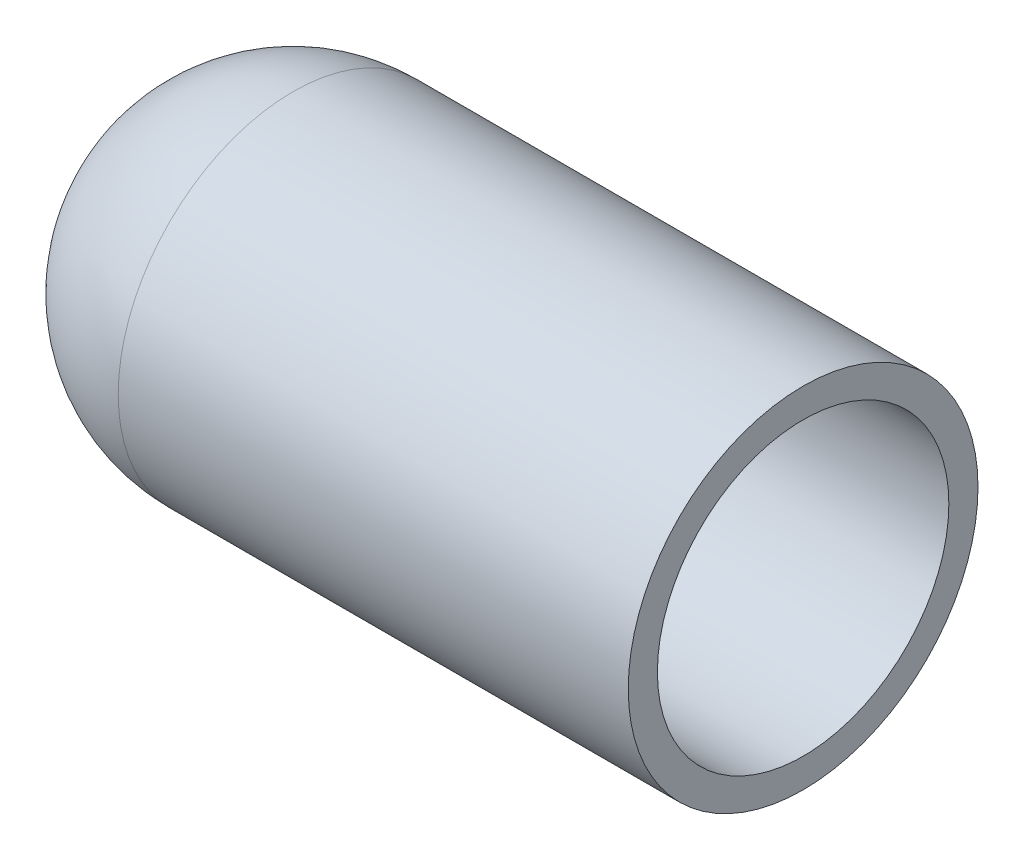
from build123d import *

# Parameters (mm, degrees)
SHELL1_T = -2


with BuildPart() as part:
    # Sketch1 → Revolve1 (revolve)
    with BuildSketch(Plane(origin=(0, 0, 0), x_dir=(1, 0, 0), z_dir=(0, 1, 0)), mode=Mode.PRIVATE) as revolve1_sk:
        with BuildLine():
            Line((-16.159952826, 12), (18.840047174, 12))
            Line((18.840047174, 12), (18.840047174, 0))
            Line((18.840047174, 0), (-28.159952826, 0))
            ThreePointArc((-28.159952826, 0), (-24.645234201, 8.485281374), (-16.159952826, 12))
        make_face()
    revolve(revolve1_sk.sketch.rotate(Axis((-16.159952826, 0, 0), (1, 0, 0)), 180), axis=Axis((-16.159952826, 0, 0), (1, 0, 0)))

    # Shell1
    shell1_openings = [part.faces().sort_by_distance(p)[0] for p in [
        (18.840047174, 0, 0),
    ]]
    offset(amount=SHELL1_T, openings=shell1_openings, kind=Kind.INTERSECTION)


solid = part.part
